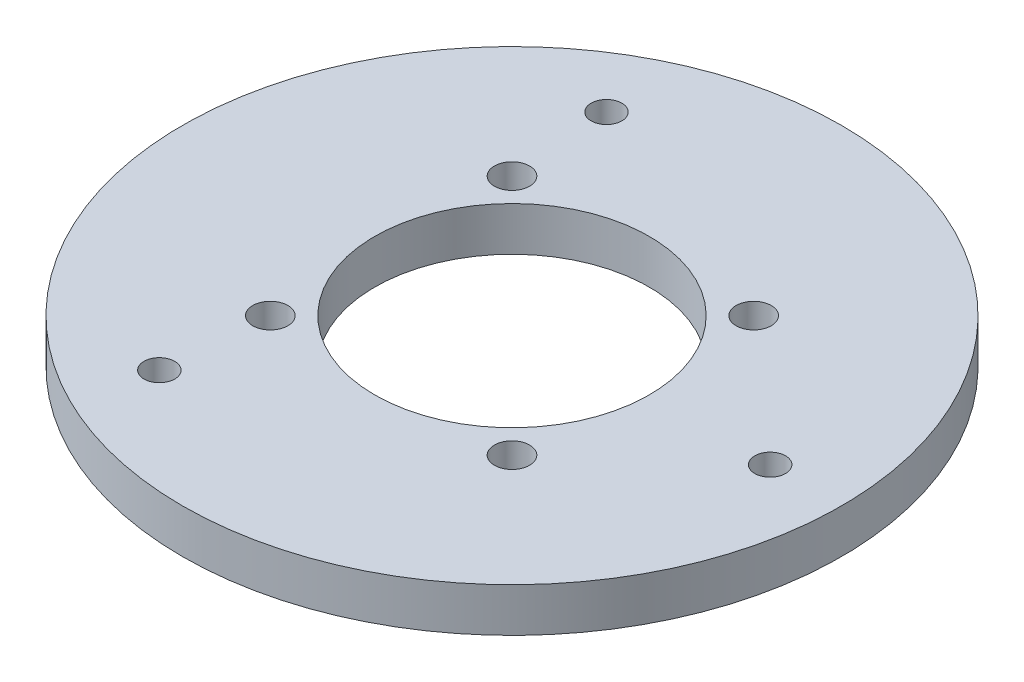
from build123d import *

# Parameters (mm, degrees)
SKETCH_1_R          = 30
SKETCH_1_R_2        = 12.5
EXTRUDE_1_DEPTH     = 4
SKETCH_2_R          = 1.6
CUT_EXTRUDE_1_DEPTH = 4
SKETCH_3_R          = 1.4
CUT_EXTRUDE_2_DEPTH = 10


with BuildPart() as part:
    # 草图1 → 凸台-拉伸1 (new body)
    with BuildSketch(Plane(origin=(0, 0, 0), x_dir=(1, 0, 0), z_dir=(0, 1, 0))):
        with Locations(Location((0, 0, 0), (0, 0, 270))):
            Circle(SKETCH_1_R)
        with Locations(Location((0, 0, 0), (0, 0, 270))):
            Circle(SKETCH_1_R_2, mode=Mode.SUBTRACT)
    extrude(amount=EXTRUDE_1_DEPTH)

    # 草图2 → 切除-拉伸1 (cut)
    with BuildSketch(Plane(origin=(0, 4, 0), x_dir=(1, 0, 0), z_dir=(0, 1, 0))):
        with Locations(Location((11, 11, 0), (0, 0, 270))):
            Circle(SKETCH_2_R)
        with Locations(Location((11, -11, 0), (0, 0, 270))):
            Circle(SKETCH_2_R)
        with Locations(Location((-11, -11, 0), (0, 0, 270))):
            Circle(SKETCH_2_R)
        with Locations(Location((-11, 11, 0), (0, 0, 270))):
            Circle(SKETCH_2_R)
    extrude(amount=-CUT_EXTRUDE_1_DEPTH, mode=Mode.SUBTRACT)

    # 草图3 → 切除-拉伸2 (cut)
    with BuildSketch(Plane(origin=(0, 4, 0), x_dir=(1, 0, 0), z_dir=(0, 1, 0))):
        with Locations(Location((23.5, 0, 0), (0, 0, 270))):
            Circle(SKETCH_3_R)
        with Locations(Location((-11.75, 20.351596989, 0), (0, 0, 270))):
            Circle(SKETCH_3_R)
        with Locations(Location((-11.75, -20.351596989, 0), (0, 0, 270))):
            Circle(SKETCH_3_R)
    extrude(amount=-CUT_EXTRUDE_2_DEPTH, mode=Mode.SUBTRACT)


solid = part.part
